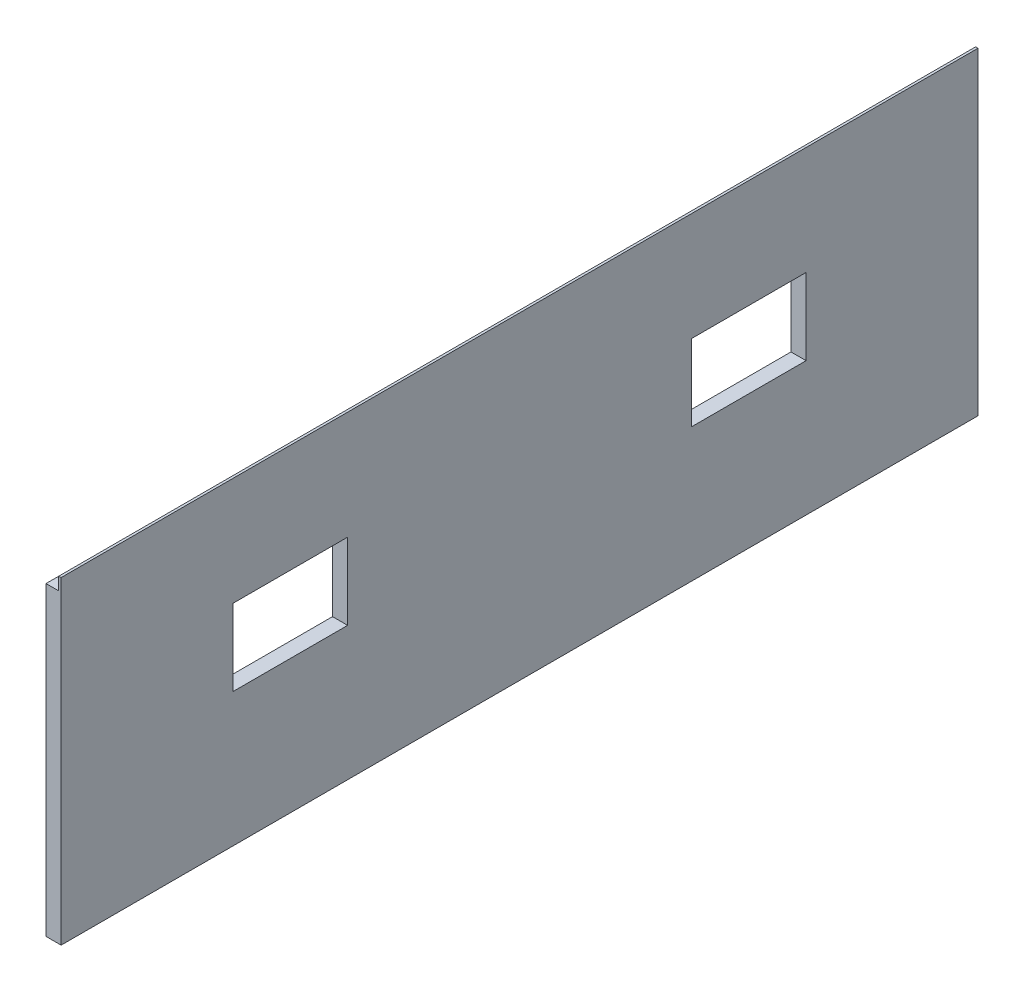
from build123d import *

# Parameters (mm, degrees)
SKETCH1_W           = 330.2
SKETCH1_H           = 2336.8
SKETCH1_W_2         = 914.4
SKETCH1_H_2         = 609.6
SKETCH1_W_3         = 355.6
SKETCH1_H_3         = 914.4
BOSS_EXTRUDE1_DEPTH = 101.6
SKETCH2_W           = 7315.2
SKETCH2_H           = 2438.4
SKETCH2_W_2         = 914.4
SKETCH2_H_2         = 609.6
BOSS_EXTRUDE2_DEPTH = 19.05
SKETCH3_W           = 19.05
SKETCH3_H           = 7315.2
BOSS_EXTRUDE3_DEPTH = 101.6


with BuildPart() as part:
    # Sketch1 → Boss-Extrude1 (new body)
    with BuildSketch(Plane(origin=(0, 0, 0), x_dir=(0, 0, -1), z_dir=(1, 0, 0))):
        Polygon((0, 0), (3657.6, 0), (3657.6, 2438.4), (-3657.6, 2438.4), (-3657.6, 0), align=None)
        Polygon((1828.8, 1778), (2006.6, 1778), (2006.6, 2387.6), (1651, 2387.6), (1651, 1778), align=None, mode=Mode.SUBTRACT)
        with Locations((-3441.7, 1219.2)):
            Rectangle(SKETCH1_W, SKETCH1_H, mode=Mode.SUBTRACT)
        with Locations((3441.7, 1219.2)):
            Rectangle(SKETCH1_W, SKETCH1_H, mode=Mode.SUBTRACT)
        Polygon((-1828.8, 1778), (-1651, 1778), (-1651, 2387.6), (-2006.6, 2387.6), (-2006.6, 1778), align=None, mode=Mode.SUBTRACT)
        with Locations((-1828.8, 1371.6)):
            Rectangle(SKETCH1_W_2, SKETCH1_H_2, mode=Mode.SUBTRACT)
        Polygon((1828.8, 1676.4), (1371.6, 1676.4), (1371.6, 1066.8), (2286, 1066.8), (2286, 1676.4), align=None, mode=Mode.SUBTRACT)
        with Locations((203.2, 1219.2)):
            Rectangle(SKETCH1_W_3, SKETCH1_H, mode=Mode.SUBTRACT)
        with Locations((-203.2, 1219.2)):
            Rectangle(SKETCH1_W_3, SKETCH1_H, mode=Mode.SUBTRACT)
        with Locations((609.6, 1219.2)):
            Rectangle(SKETCH1_W_3, SKETCH1_H, mode=Mode.SUBTRACT)
        with Locations((1016, 1219.2)):
            Rectangle(SKETCH1_W_3, SKETCH1_H, mode=Mode.SUBTRACT)
        with Locations((1422.4, 508)):
            Rectangle(SKETCH1_W_3, SKETCH1_H_3, mode=Mode.SUBTRACT)
        with Locations((1828.8, 508)):
            Rectangle(SKETCH1_W_3, SKETCH1_H_3, mode=Mode.SUBTRACT)
        with Locations((2235.2, 508)):
            Rectangle(SKETCH1_W_3, SKETCH1_H_3, mode=Mode.SUBTRACT)
        with Locations((2641.6, 1219.2)):
            Rectangle(SKETCH1_W_3, SKETCH1_H, mode=Mode.SUBTRACT)
        with Locations((3048, 1219.2)):
            Rectangle(SKETCH1_W_3, SKETCH1_H, mode=Mode.SUBTRACT)
        with Locations((1422.4, 2082.8)):
            Rectangle(SKETCH1_W_3, SKETCH1_H_2, mode=Mode.SUBTRACT)
        with Locations((2235.2, 2082.8)):
            Rectangle(SKETCH1_W_3, SKETCH1_H_2, mode=Mode.SUBTRACT)
        with Locations((-609.6, 1219.2)):
            Rectangle(SKETCH1_W_3, SKETCH1_H, mode=Mode.SUBTRACT)
        with Locations((-1016, 1219.2)):
            Rectangle(SKETCH1_W_3, SKETCH1_H, mode=Mode.SUBTRACT)
        with Locations((-1422.4, 508)):
            Rectangle(SKETCH1_W_3, SKETCH1_H_3, mode=Mode.SUBTRACT)
        with Locations((-1828.8, 508)):
            Rectangle(SKETCH1_W_3, SKETCH1_H_3, mode=Mode.SUBTRACT)
        with Locations((-2235.2, 508)):
            Rectangle(SKETCH1_W_3, SKETCH1_H_3, mode=Mode.SUBTRACT)
        with Locations((-2641.6, 1219.2)):
            Rectangle(SKETCH1_W_3, SKETCH1_H, mode=Mode.SUBTRACT)
        with Locations((-3048, 1219.2)):
            Rectangle(SKETCH1_W_3, SKETCH1_H, mode=Mode.SUBTRACT)
        with Locations((-2235.2, 2082.8)):
            Rectangle(SKETCH1_W_3, SKETCH1_H_2, mode=Mode.SUBTRACT)
        with Locations((-1422.4, 2082.8)):
            Rectangle(SKETCH1_W_3, SKETCH1_H_2, mode=Mode.SUBTRACT)
    extrude(amount=BOSS_EXTRUDE1_DEPTH)

    # Sketch2 → Boss-Extrude2 (add)
    with BuildSketch(Plane(origin=(101.6, 0, 0), x_dir=(0, 0, -1), z_dir=(1, 0, 0))):
        with Locations((0, 1219.2)):
            Rectangle(SKETCH2_W, SKETCH2_H)
        with Locations((1828.8, 1371.6)):
            Rectangle(SKETCH2_W_2, SKETCH2_H_2, mode=Mode.SUBTRACT)
        with Locations((-1828.8, 1371.6)):
            Rectangle(SKETCH2_W_2, SKETCH2_H_2, mode=Mode.SUBTRACT)
    extrude(amount=BOSS_EXTRUDE2_DEPTH)

    # Sketch3 → Boss-Extrude3 (add)
    with BuildSketch(Plane(origin=(0, 2438.4, 0), x_dir=(1, 0, 0), z_dir=(0, 1, 0))):
        with Locations((111.125, 0)):
            Rectangle(SKETCH3_W, SKETCH3_H)
    extrude(amount=BOSS_EXTRUDE3_DEPTH)


solid = part.part
